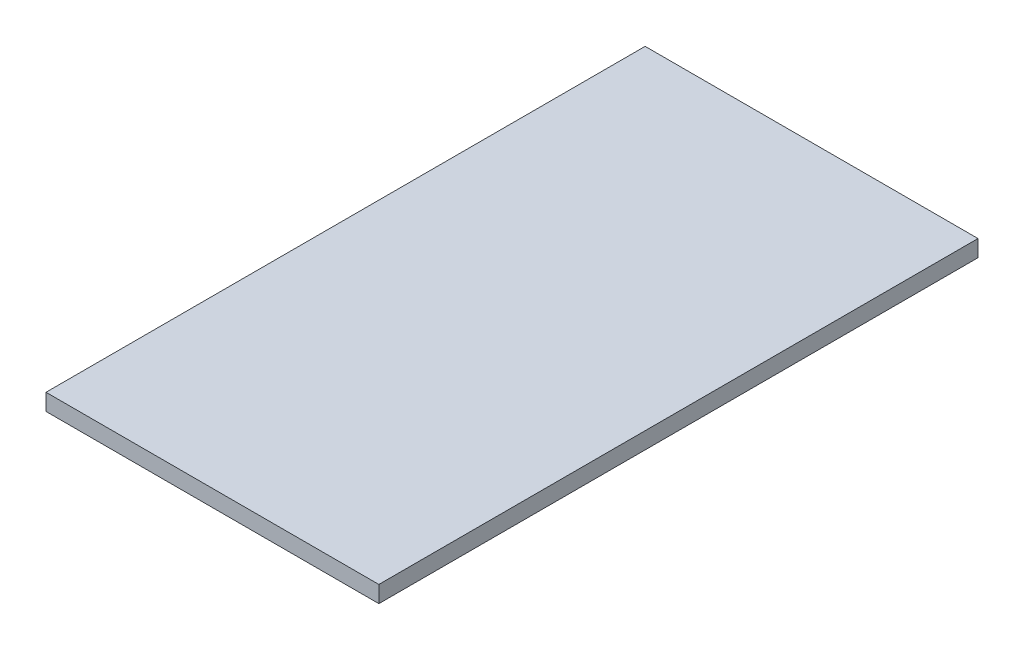
from build123d import *

# Parameters (mm, degrees)
SKETCH2_W           = 127
SKETCH2_H           = 228.6
BOSS_EXTRUDE1_DEPTH = 6.35


with BuildPart() as part:
    # Sketch2 → Boss-Extrude1 (new body)
    with BuildSketch(Plane(origin=(0, 0, 0), x_dir=(1, 0, 0), z_dir=(0, 1, 0))):
        with Locations((63.5, 114.3)):
            Rectangle(SKETCH2_W, SKETCH2_H)
    extrude(amount=BOSS_EXTRUDE1_DEPTH)


solid = part.part
